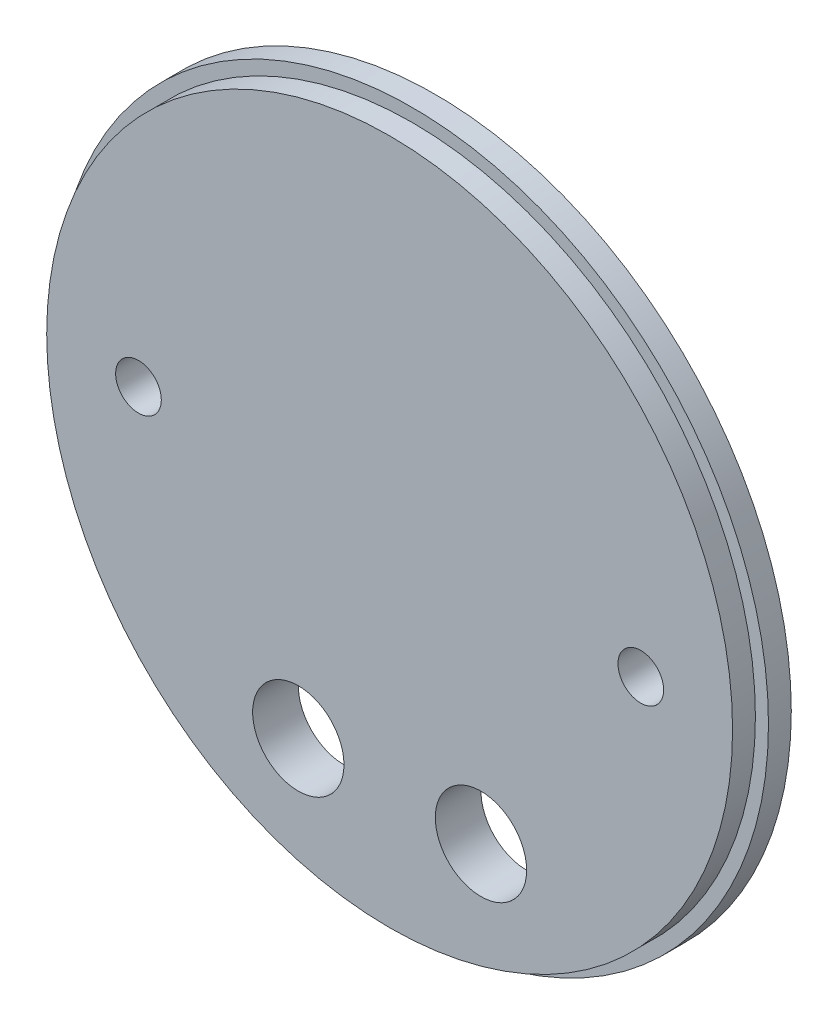
from build123d import *

# Parameters (mm, degrees)
SKETCH1_R           = 49.5046
BOSS_EXTRUDE1_DEPTH = 3.175
SKETCH2_R           = 47.6885
BOSS_EXTRUDE2_DEPTH = 3.175
SKETCH3_R           = 6.35
SKETCH3_R_2         = 3.175
CUT_EXTRUDE1_DEPTH  = 71.297463271


with BuildPart() as part:
    # Sketch1 → Boss-Extrude1 (new body)
    with BuildSketch(Plane.XY):
        Circle(SKETCH1_R)
    extrude(amount=BOSS_EXTRUDE1_DEPTH)

    # Sketch2 → Boss-Extrude2 (add)
    with BuildSketch(Plane.XY.offset(3.175)):
        Circle(SKETCH2_R)
    extrude(amount=BOSS_EXTRUDE2_DEPTH)

    # Sketch3 → Cut-Extrude1 (cut, through all)
    with BuildSketch(Plane.XY.offset(6.35)):
        with Locations((-12.7, -31.235352443)):
            Circle(SKETCH3_R)
        with Locations((12.7, -31.235352443)):
            Circle(SKETCH3_R)
        with Locations((-34.925, 0)):
            Circle(SKETCH3_R_2)
        with Locations((34.925, 0)):
            Circle(SKETCH3_R_2)
    extrude(amount=-CUT_EXTRUDE1_DEPTH, mode=Mode.SUBTRACT)


solid = part.part
